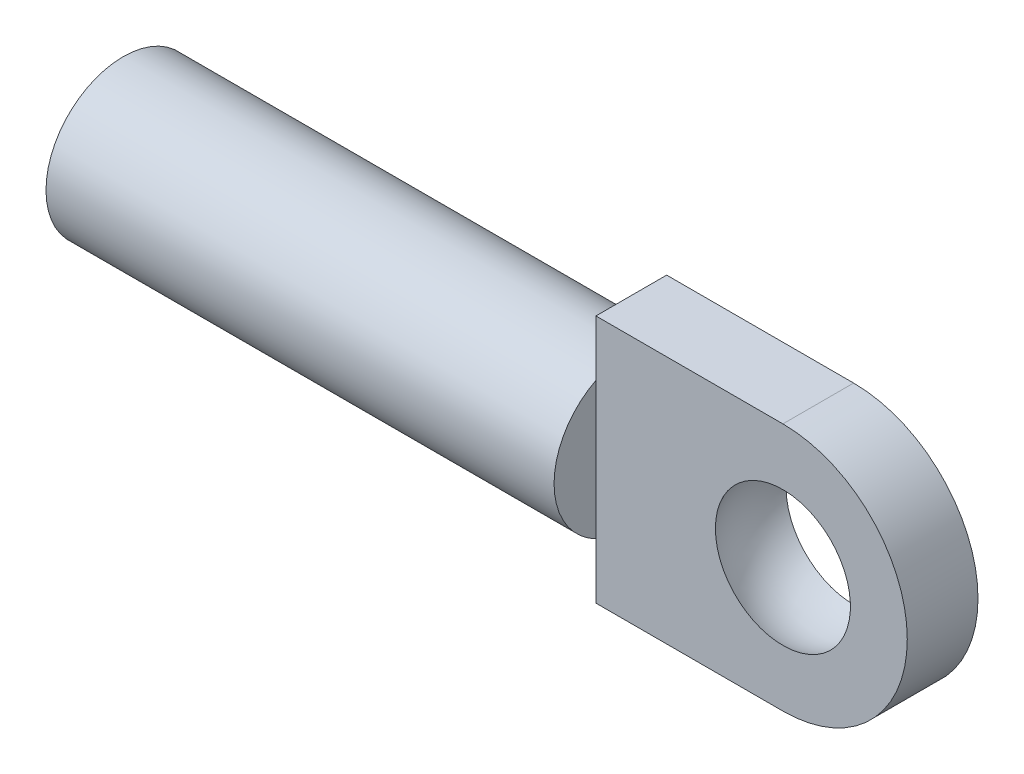
from build123d import *

# Parameters (mm, degrees)
EXTRUDE1_DEPTH      = 1.1049
EXTRUDE1_DEPTH_BACK = 1.1049
SKETCH2_R           = 2.413
EXTRUDE2_DEPTH      = 15.875
SKETCH3_R           = 1.2065
EXTRUDE3_DEPTH      = 14.859


with BuildPart() as part:
    # Sketch1 → Extrude1 (new, two sides: drawn at the far end of the back side and taken through both)
    with BuildSketch(Plane.XY.offset(-EXTRUDE1_DEPTH_BACK)):
        with BuildLine():
            Line((0, 3.8862), (-5.842, 3.8862))
            Line((-5.842, 3.8862), (-5.842, -3.8862))
            Line((-5.842, -3.8862), (0, -3.8862))
            ThreePointArc((0, -3.8862), (3.8862, 0), (0, 3.8862))
        make_face()
    extrude(amount=EXTRUDE1_DEPTH + EXTRUDE1_DEPTH_BACK)

    # Sketch2 → Extrude2 (add)
    with BuildSketch(Plane.ZY.offset(5.842)):
        with Locations(Location((0, 0, 0), (0, 0, 117.251341936))):
            Circle(SKETCH2_R)
    extrude(amount=EXTRUDE2_DEPTH)

    # Sketch3 → Extrude3 (cut)
    with BuildSketch(Plane.ZY.offset(21.717)):
        Circle(SKETCH3_R)
    extrude(amount=-EXTRUDE3_DEPTH, mode=Mode.SUBTRACT)

    # Sketch6 → Cut-Revolve1 (revolve, cut)
    with BuildSketch(Plane.XY):
        with BuildLine():
            Line((0, -2.38125), (0, 2.38125))
            ThreePointArc((0, 2.38125), (-2.38125, 0), (0, -2.38125))
        make_face()
    revolve(axis=Axis((0, -2.38125, 0), (0, 1, 0)), mode=Mode.SUBTRACT)


solid = part.part
